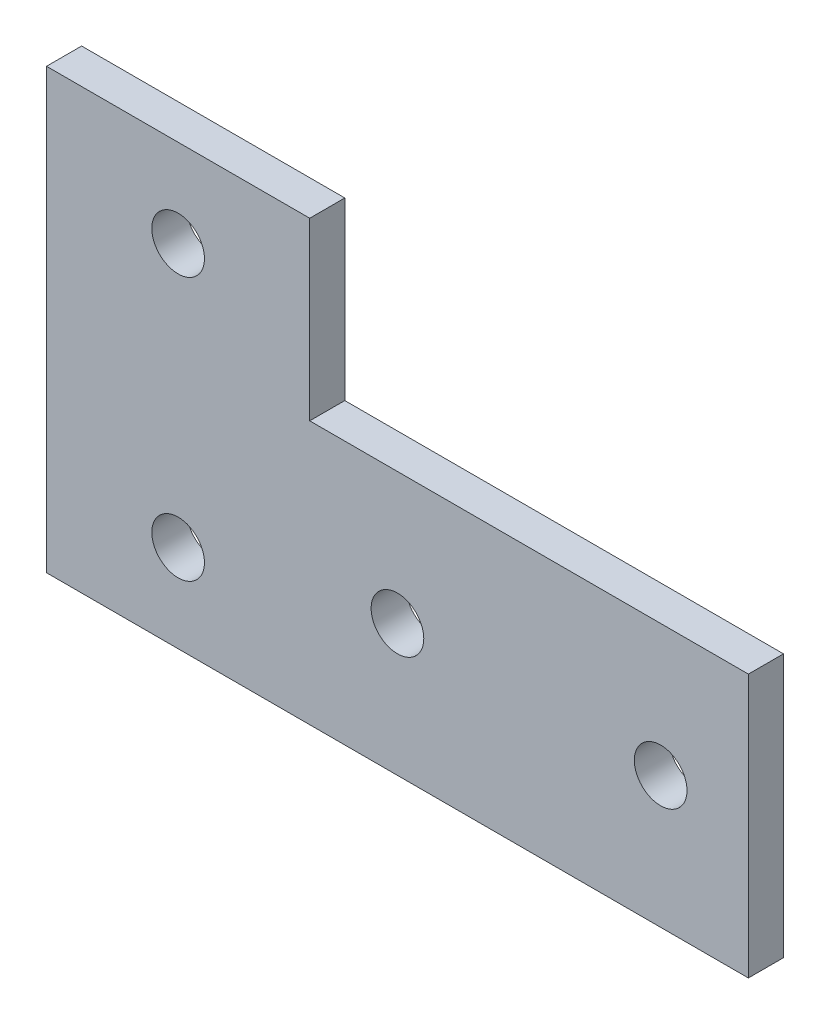
from build123d import *

# Parameters (mm, degrees)
EXTRUSION1_DEPTH = 2
ESQUISSE2_R      = 1.5
EXTRUSION2_DEPTH = 48.212286536


with BuildPart() as part:
    # Esquisse1 → Extrusion1 (new body)
    with BuildSketch(Plane.XY):
        Polygon((0, 0), (15, 0), (40, 0), (40, 15), (15, 15), (15, 25), (0, 25), align=None)
    extrude(amount=EXTRUSION1_DEPTH)

    # Esquisse2 → Extrusion2 (cut, through all)
    with BuildSketch(Plane.XY.offset(2)):
        with Locations((7.5, 20)):
            Circle(ESQUISSE2_R)
        with Locations((7.5, 5)):
            Circle(ESQUISSE2_R)
        with Locations((20, 7.5)):
            Circle(ESQUISSE2_R)
        with Locations((35, 7.5)):
            Circle(ESQUISSE2_R)
    extrude(amount=-EXTRUSION2_DEPTH, mode=Mode.SUBTRACT)


solid = part.part
